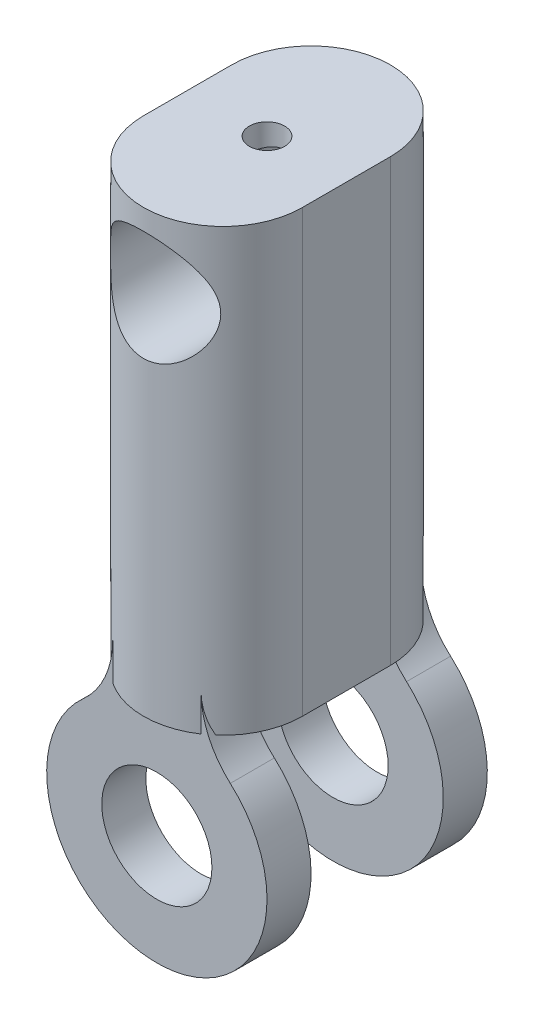
from build123d import *

# Parameters (mm, degrees)
BOSS_EXTRUDE1_START     = 7.5
SKETCH1_R               = 6.25
BOSS_EXTRUDE1_DEPTH     = 5
BOSS_EXTRUDE2_START     = -7.5
SKETCH1_2_R             = 6.25
BOSS_EXTRUDE2_DEPTH     = 5
BOSS_EXTRUDE3_START     = 12.5
BOSS_EXTRUDE3_DEPTH     = 50
SKETCH3_R               = 2
CUT_EXTRUDE1_DEPTH      = 56
CUT_EXTRUDE2_DEPTH      = 47
CUT_EXTRUDE2_DEPTH_BACK = 29
SKETCH4_R               = 6.25


with BuildPart() as part:
    # Sketch1 → Boss-Extrude1 (new body)
    with BuildSketch(Plane.XY.offset(BOSS_EXTRUDE1_START)):
        with BuildLine():
            Line((5, 16.770509831), (5, 18.456439237))
            Line((5, 18.456439237), (-5, 18.456439237))
            Line((-5, 18.456439237), (-5, 16.770509831))
            ThreePointArc((-5, 16.770509831), (-5.871290708, 12.688026927), (-8.333333333, 9.316949906))
            ThreePointArc((-8.333333333, 9.316949906), (0, -12.5), (8.333333333, 9.316949906))
            ThreePointArc((8.333333333, 9.316949906), (5.871290708, 12.688026927), (5, 16.770509831))
        make_face()
        Circle(SKETCH1_R, mode=Mode.SUBTRACT)
    extrude(amount=BOSS_EXTRUDE1_DEPTH)



with BuildPart() as body_2:
    # Sketch1<2> → Boss-Extrude2 (new body)
    with BuildSketch(Plane.XY.offset(BOSS_EXTRUDE2_START)):
        with BuildLine():
            Line((5, 16.770509831), (5, 18.456439237))
            Line((5, 18.456439237), (-5, 18.456439237))
            Line((-5, 18.456439237), (-5, 16.770509831))
            ThreePointArc((-5, 16.770509831), (-5.871290708, 12.688026927), (-8.333333333, 9.316949906))
            ThreePointArc((-8.333333333, 9.316949906), (0, -12.5), (8.333333333, 9.316949906))
            ThreePointArc((8.333333333, 9.316949906), (5.871290708, 12.688026927), (5, 16.770509831))
        make_face()
        Circle(SKETCH1_2_R, mode=Mode.SUBTRACT)
    extrude(amount=-BOSS_EXTRUDE2_DEPTH)


with BuildPart() as part_1:
    add(part.part)

    add(body_2.part)  # Boss-Extrude3 merges body 2
    # Sketch2 → Boss-Extrude3 (add)
    with BuildSketch(Plane(origin=(0, 0, 0), x_dir=(1, 0, 0), z_dir=(0, 1, 0)).offset(BOSS_EXTRUDE3_START)):
        with BuildLine():
            Line((9.013878189, 5), (9.013878189, -5))
            ThreePointArc((9.013878189, -5), (0, -14.013878189), (-9.013878189, -5))
            Line((-9.013878189, -5), (-9.013878189, 5))
            ThreePointArc((-9.013878189, 5), (0, 14.013878189), (9.013878189, 5))
        make_face()
    extrude(amount=BOSS_EXTRUDE3_DEPTH)

    # Sketch3 → Cut-Extrude1 (cut)
    with BuildSketch(Plane.XZ.offset(-12.5)):
        Circle(SKETCH3_R)
    extrude(amount=-CUT_EXTRUDE1_DEPTH, mode=Mode.SUBTRACT)

    # Sketch4 → Cut-Extrude2 (cut, two sides: drawn at the far end of the back side and taken through both)
    with BuildSketch(Plane.XY.offset(-CUT_EXTRUDE2_DEPTH_BACK)):
        with Locations((0, 53.915919761)):
            Circle(SKETCH4_R)
    extrude(amount=CUT_EXTRUDE2_DEPTH + CUT_EXTRUDE2_DEPTH_BACK, mode=Mode.SUBTRACT)


solid = part_1.part
